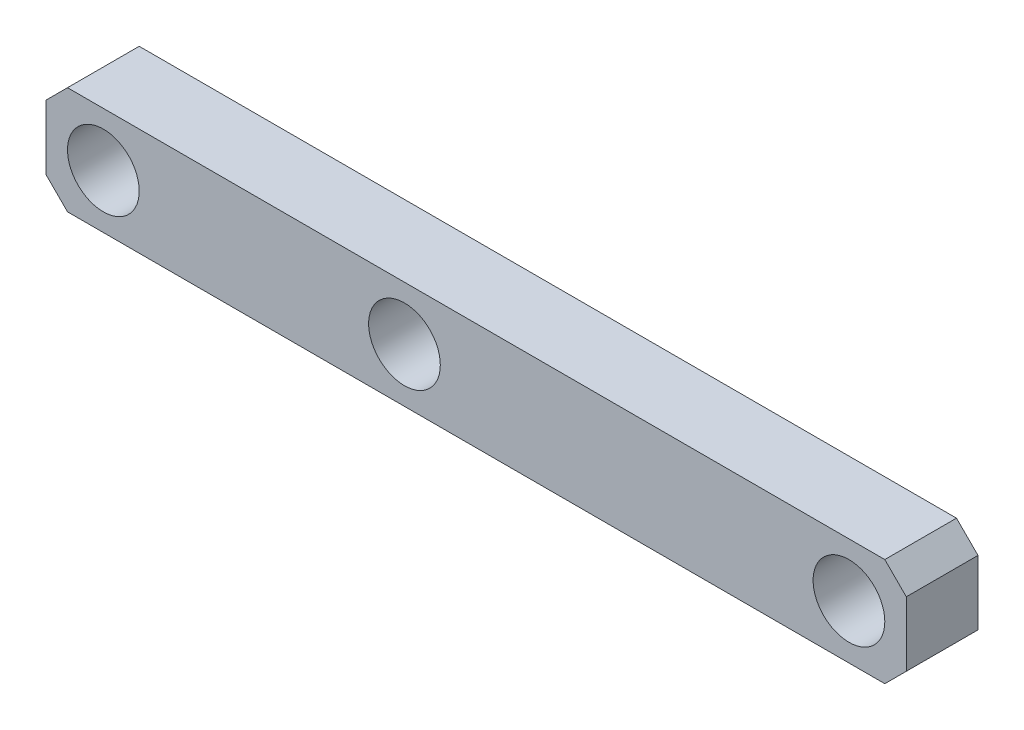
from build123d import *

# Parameters (mm, degrees)
SKETCH_1_W      = 120
SKETCH_1_H      = 15
SKETCH_1_R      = 5
EXTRUDE_2_DEPTH = 10
CHAMFER_2_SIZE  = 3


with BuildPart() as part:
    # 草图1 → 凸台-拉伸2 (new body)
    with BuildSketch(Plane.XY):
        with Locations((-12.990353698, 6.149517685)):
            Rectangle(SKETCH_1_W, SKETCH_1_H)
        with Locations((-64.990353698, 6.149517685)):
            Circle(SKETCH_1_R, mode=Mode.SUBTRACT)
        with Locations((39.009646302, 6.149517685)):
            Circle(SKETCH_1_R, mode=Mode.SUBTRACT)
        with Locations((-22.990353698, 6.149517685)):
            Circle(SKETCH_1_R, mode=Mode.SUBTRACT)
    extrude(amount=EXTRUDE_2_DEPTH)

    # 倒角2
    chamfer_2_edges = [part.edges().sort_by_distance(p)[0] for p in [
        (47.009646302, -1.350482315, 5),
        (-72.990353698, -1.350482315, 5),
        (-72.990353698, 13.649517685, 5),
        (47.009646302, 13.649517685, 5),
    ]]
    chamfer(chamfer_2_edges, length=CHAMFER_2_SIZE)


solid = part.part
